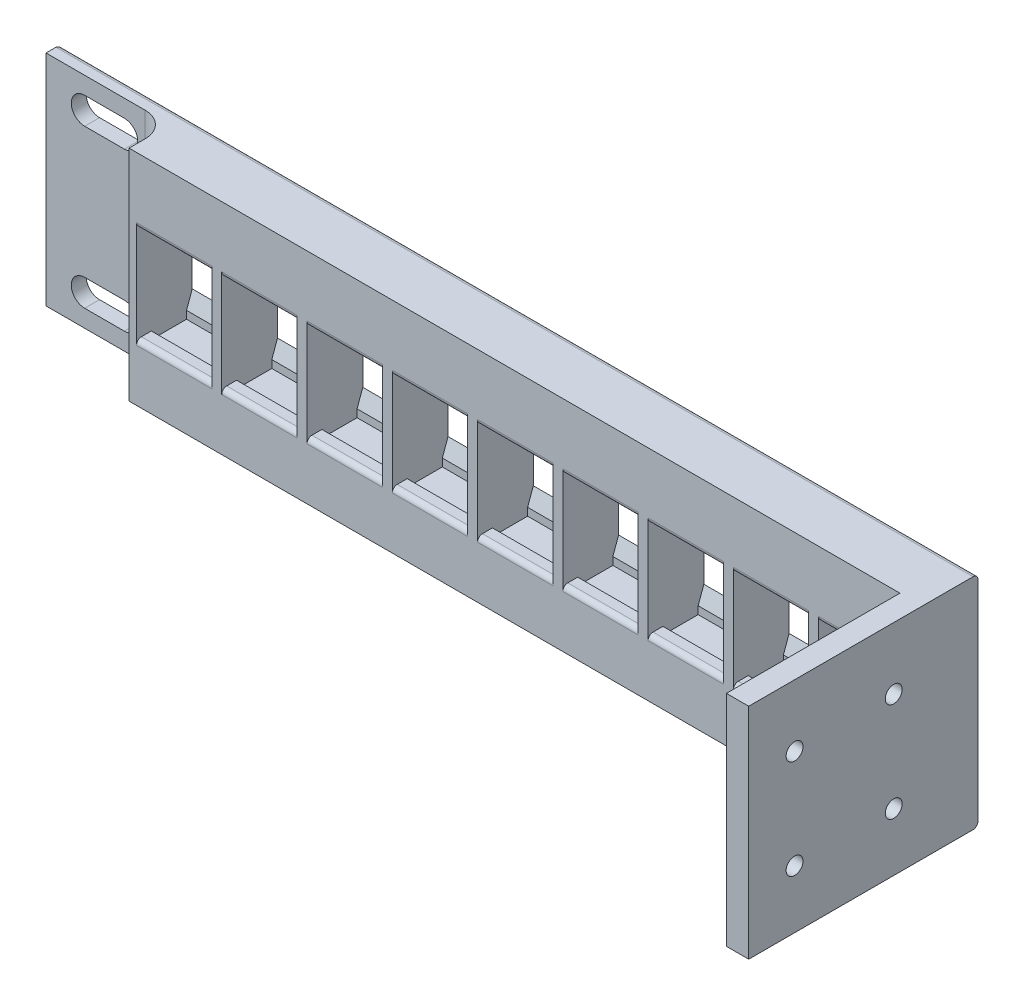
from build123d import *

# Parameters (mm, degrees)
SKETCH1_W                      = 185
SKETCH1_H                      = 44.2
BOSS_EXTRUDE1_DEPTH            = 11.25
SKETCH2_W                      = 25
SKETCH2_H                      = 44.2
CUT_EXTRUDE1_DEPTH             = 8.25
FILLET1_R                      = 5
CUT_EXTRUDE2_DEPTH             = 15.2
LPATTERN1_COUNT                = 9
LPATTERN1_PITCH                = 17.2
SKETCH4_W                      = 4.5
SKETCH4_H                      = 44.2
BOSS_EXTRUDE2_DEPTH            = 35
CBORE_FOR_M3_SHCS1_D           = 3.4
CBORE_FOR_M3_SHCS1_DEPTH       = 10.1
CBORE_FOR_M3_SHCS1_CBORE_D     = 6.5
CBORE_FOR_M3_SHCS1_CBORE_DEPTH = 3
CBORE_FOR_M3_SHCS1_TIP         = 1.021463052
CUT_EXTRUDE3_DEPTH             = 35
FILLET2_R                      = 1
FILLET3_R                      = 1


with BuildPart() as part:
    # Sketch1 → Boss-Extrude1 (new body)
    with BuildSketch(Plane.XY):
        Rectangle(SKETCH1_W, SKETCH1_H)
    extrude(amount=BOSS_EXTRUDE1_DEPTH)

    # Sketch2 → Cut-Extrude1 (cut)
    with BuildSketch(Plane.XY.offset(11.25)):
        with Locations((-80, 0)):
            Rectangle(SKETCH2_W, SKETCH2_H)
    extrude(amount=-CUT_EXTRUDE1_DEPTH, mode=Mode.SUBTRACT)

    # Fillet1
    fillet1_edges = [part.edges().sort_by_distance(p)[0] for p in [
        (-67.5, 0, 3),
    ]]
    fillet(fillet1_edges, radius=FILLET1_R)

    # Sketch3 → Cut-Extrude2 (cut)
    with BuildSketch(Plane.ZY.offset(66)):
        Polygon((0, 8.85), (1.15, 8.85), (1.15, 10.35), (8.25, 10.35), (8.25, 8.85), (11.25, 8.85), (11.25, -10.6), (8.25, -10.6), (8.25, -12.1), (1.15, -12.1), (1.15, -10.545741226), (0, -7.36), align=None)
    cut_extrude2 = extrude(amount=-CUT_EXTRUDE2_DEPTH, mode=Mode.SUBTRACT)

    # LPattern1: Cut-Extrude2 ×9
    with Locations(*[(i * LPATTERN1_PITCH, 0, 0) for i in range(1, LPATTERN1_COUNT)]):
        add(cut_extrude2, mode=Mode.SUBTRACT)

    # Sketch4 → Boss-Extrude2 (add)
    with BuildSketch(Plane.XY.offset(11.25)):
        with Locations((90.25, 0)):
            Rectangle(SKETCH4_W, SKETCH4_H)
    extrude(amount=BOSS_EXTRUDE2_DEPTH)

    # CBORE for M3 SHCS1
    with Locations(Plane.ZY.offset(-86.8)):
        with Locations((17, 9.6), (37, 9.6), (17, -10.4), (37, -10.4)):
            CounterBoreHole(CBORE_FOR_M3_SHCS1_D / 2, CBORE_FOR_M3_SHCS1_CBORE_D / 2, CBORE_FOR_M3_SHCS1_CBORE_DEPTH, depth=CBORE_FOR_M3_SHCS1_DEPTH)
            with Locations((0, 0, -(CBORE_FOR_M3_SHCS1_DEPTH + CBORE_FOR_M3_SHCS1_TIP / 2))):  # 118° drill point
                Cone(0, CBORE_FOR_M3_SHCS1_D / 2, CBORE_FOR_M3_SHCS1_TIP, mode=Mode.SUBTRACT)

    # Sketch10 → Cut-Extrude3 (cut)
    with BuildSketch(Plane(origin=(0, 0, 0), x_dir=(-1, 0, 0), z_dir=(0, 0, -1))):
        with BuildLine():
            Line((76.7, 18.6), (84.7, 18.6))
            ThreePointArc((84.7, 18.6), (87.4, 15.9), (84.7, 13.2))
            Line((84.7, 13.2), (76.7, 13.2))
            ThreePointArc((76.7, 13.2), (74, 15.9), (76.7, 18.6))
        make_face()
        with BuildLine():
            Line((76.7, -13.2), (84.7, -13.2))
            ThreePointArc((84.7, -13.2), (87.4, -15.9), (84.7, -18.6))
            Line((84.7, -18.6), (76.7, -18.6))
            ThreePointArc((76.7, -18.6), (74, -15.9), (76.7, -13.2))
        make_face()
    extrude(amount=-CUT_EXTRUDE3_DEPTH, mode=Mode.SUBTRACT)

    # Fillet2
    fillet2_edges = [part.edges().sort_by_distance(p)[0] for p in [
        (-41.2, 8.85, 11.25),
        (-41.2, -10.6, 11.25),
        (-24, 8.85, 11.25),
        (-24, -10.6, 11.25),
        (-6.8, 8.85, 11.25),
        (-6.8, -10.6, 11.25),
        (10.4, 8.85, 11.25),
        (10.4, -10.6, 11.25),
        (27.6, 8.85, 11.25),
        (27.6, -10.6, 11.25),
        (44.8, 8.85, 11.25),
        (44.8, -10.6, 11.25),
        (62, 8.85, 11.25),
        (62, -10.6, 11.25),
        (79.2, 8.85, 11.25),
        (79.2, -10.6, 11.25),
        (-58.4, 8.85, 11.25),
        (-58.4, -10.6, 11.25),
    ]]
    fillet(fillet2_edges, radius=FILLET2_R)

    # Fillet3
    fillet3_edges = [part.edges().sort_by_distance(p)[0] for p in [
        (0, -22.1, 0),
        (-92.5, 0, 0),
        (0, 22.1, 0),
    ]]
    fillet(fillet3_edges, radius=FILLET3_R)


solid = part.part
